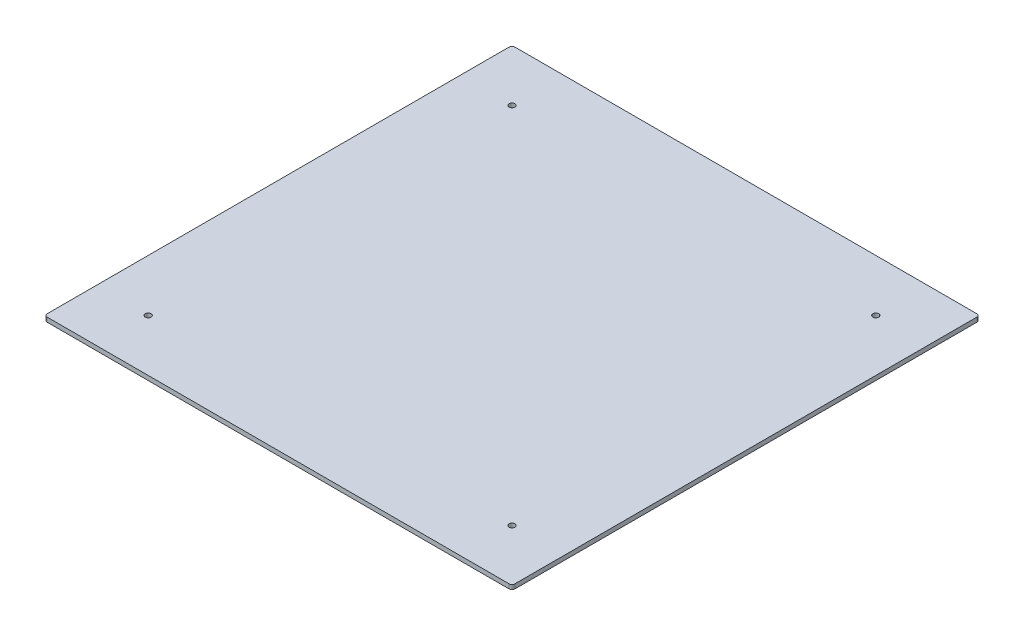
from build123d import *

# Parameters (mm, degrees)
SKETCH1_W           = 315
SKETCH1_H           = 315
BOSS_EXTRUDE1_DEPTH = 3
SKETCH3_R           = 2
CUT_EXTRUDE1_DEPTH  = 10
FILLET1_R           = 2


with BuildPart() as part:
    # Sketch1 → Boss-Extrude1 (new body)
    with BuildSketch(Plane(origin=(0, 0, 0), x_dir=(1, 0, 0), z_dir=(0, 1, 0))):
        Rectangle(SKETCH1_W, SKETCH1_H)
    extrude(amount=BOSS_EXTRUDE1_DEPTH)

    # Sketch3 → Cut-Extrude1 (cut)
    with BuildSketch(Plane(origin=(0, 3, 0), x_dir=(1, 0, 0), z_dir=(0, 1, 0))):
        with Locations(Location((-122.5, 122.5, 0), (0, 0, 270))):
            Circle(SKETCH3_R)
        with Locations(Location((122.5, 122.5, 0), (0, 0, 270))):
            Circle(SKETCH3_R)
        with Locations(Location((122.5, -122.5, 0), (0, 0, 270))):
            Circle(SKETCH3_R)
        with Locations(Location((-122.5, -122.5, 0), (0, 0, 270))):
            Circle(SKETCH3_R)
    extrude(amount=-CUT_EXTRUDE1_DEPTH, mode=Mode.SUBTRACT)

    # Fillet1
    fillet1_edges = [part.edges().sort_by_distance(p)[0] for p in [
        (-157.5, 1.5, -157.5),
        (157.5, 1.5, -157.5),
        (157.5, 1.5, 157.5),
        (-157.5, 1.5, 157.5),
    ]]
    fillet(fillet1_edges, radius=FILLET1_R)


solid = part.part
